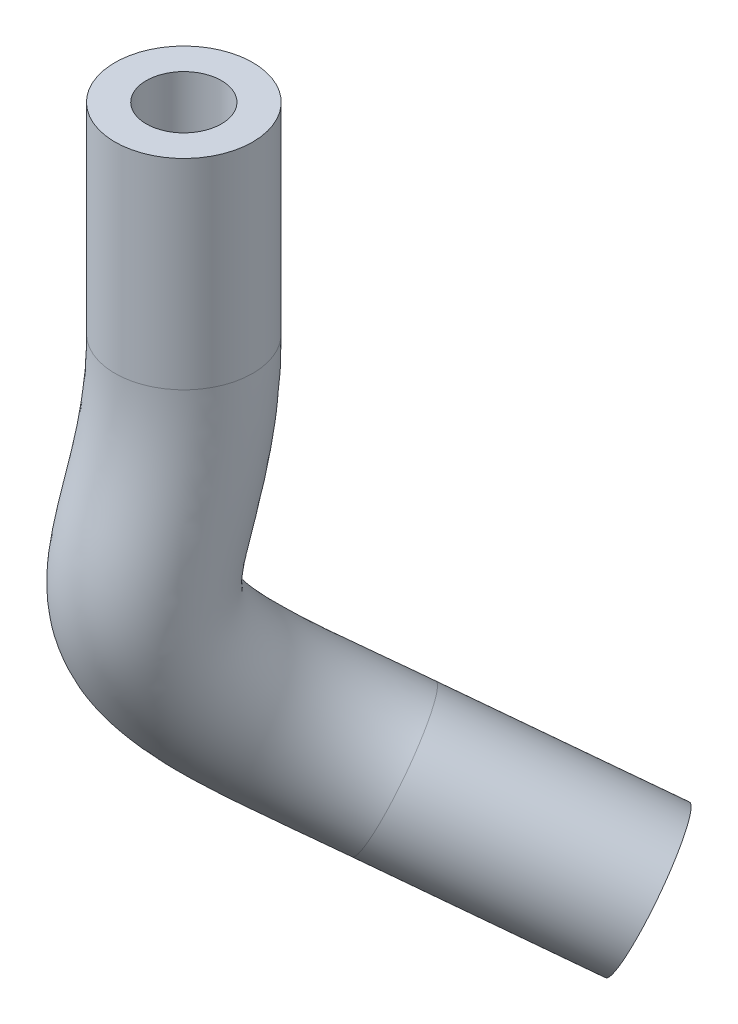
from build123d import *

# Parameters (mm, degrees)
SWEEP1_PROFILE_R     = 8.73125
CUT_SWEEP1_PROFILE_R = 4.7625


with BuildPart() as part:
    # Sweep1: sweep along a curve in space
    with BuildLine() as sweep1_path:
        Line((237.866818448, 107.61531706, -14.624873797), (219.279475976, 118.379335847, -1.067344546))
        add(Edge.make_bspline(
            [(208.20739741, 168.408442469, 14.503940753), (208.20739741, 154.381166375, 14.503940753), (205.254134169, 138.911794471, 24.636515353), (208.31033096, 124.731620106, 6.933503591), (219.279475976, 118.379335847, -1.067344546)],
            knots=[0, 0, 0, 0, 0.453922622, 1, 1, 1, 1], degree=3))
        Line((208.20739741, 168.408442469, 14.503940753), (208.20739741, 193.808442469, 14.503940753))
    # Sweep1 profile (on start of the path) → Sweep1 (sweep)
    with BuildSketch(Plane(origin=(237.866818448, 107.61531706, -14.624873797), x_dir=(-0.5892930041242715, 0, -0.8079193990059845), z_dir=(-0.7317851367038309, 0.42378026718589173, 0.5337609941192871))):
        Circle(SWEEP1_PROFILE_R)
    sweep(path=sweep1_path.line)

    # Cut-Sweep1: sweep along a curve in space
    with BuildLine() as cut_sweep1_path:
        Line((237.866818448, 107.61531706, -14.624873797), (219.279475976, 118.379335847, -1.067344546))
        add(Edge.make_bspline(
            [(208.20739741, 168.408442469, 14.503940753), (208.20739741, 154.381166375, 14.503940753), (205.254134169, 138.911794471, 24.636515353), (208.31033096, 124.731620106, 6.933503591), (219.279475976, 118.379335847, -1.067344546)],
            knots=[0, 0, 0, 0, 0.453922622, 1, 1, 1, 1], degree=3))
        Line((208.20739741, 168.408442469, 14.503940753), (208.20739741, 193.808442469, 14.503940753))
    # Cut-Sweep1 profile (on start of the path) → Cut-Sweep1 (sweep, cut)
    with BuildSketch(Plane(origin=(237.866818448, 107.61531706, -14.624873797), x_dir=(-0.5892930041242715, 0, -0.8079193990059845), z_dir=(-0.7317851367038309, 0.42378026718589173, 0.5337609941192871))):
        Circle(CUT_SWEEP1_PROFILE_R)
    sweep(path=cut_sweep1_path.line, mode=Mode.SUBTRACT)


solid = part.part
